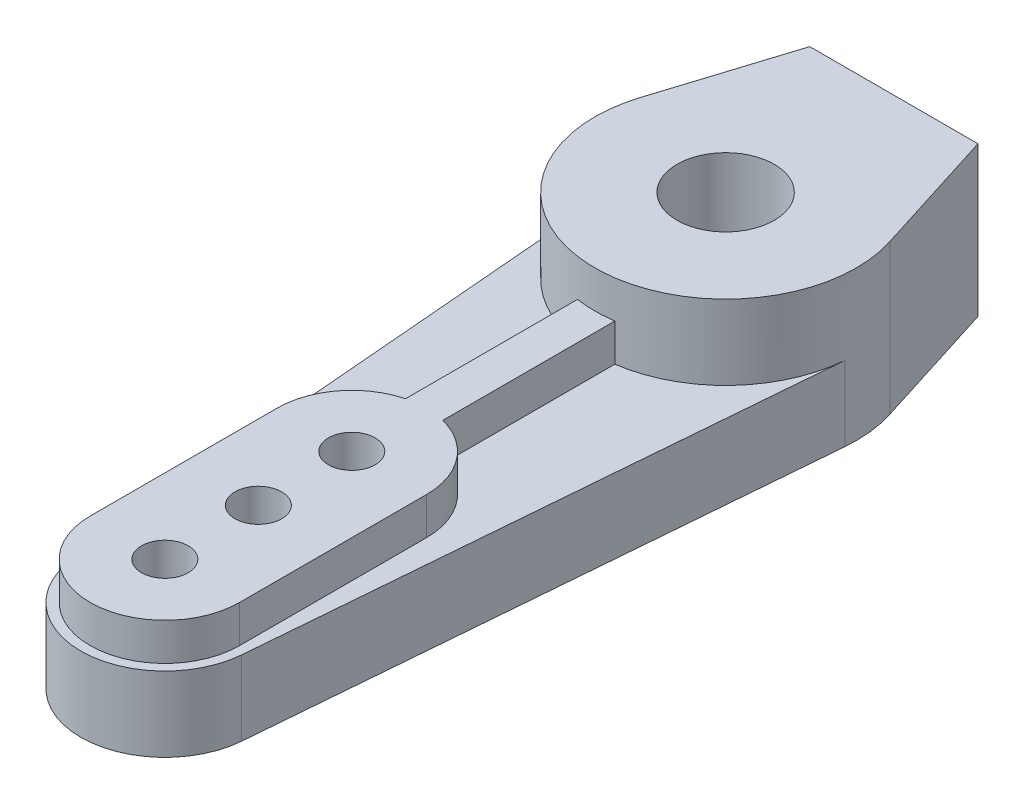
from build123d import *

# Parameters (mm, degrees)
SKETCH_1_R          = 1.25
EXTRUDE_1_DEPTH     = 4
EXTRUDE_2_DEPTH     = 4
SKETCH_3_R          = 1.25
EXTRUDE_3_DEPTH     = 2
SKETCH_4_R          = 2.6
CUT_EXTRUDE_1_DEPTH = 6
SKETCH_5_R          = 1.5
CUT_EXTRUDE_2_DEPTH = 37.100554012


with BuildPart() as part:
    # 草图1 → 凸台-拉伸1 (new body)
    with BuildSketch(Plane(origin=(0, 0, 0), x_dir=(1, 0, 0), z_dir=(0, 1, 0))):
        with BuildLine():
            Line((4.5, 9), (-4.5, 9))
            Line((-4.5, 9), (-6.675458936, 2.106714976))
            ThreePointArc((-6.675458936, 2.106714976), (-6.956816665, 0.776338774), (-6.9756521, -0.583333333))
            Line((-6.9756521, -0.583333333), (-4.484347779, -30.375))
            ThreePointArc((-4.484347779, -30.375), (0, -34.5), (4.484347779, -30.375))
            Line((4.484347779, -30.375), (6.9756521, -0.583333333))
            ThreePointArc((6.9756521, -0.583333333), (6.956816665, 0.776338774), (6.675458936, 2.106714976))
            Line((6.675458936, 2.106714976), (4.5, 9))
        make_face()
        with Locations(Location((0, -25, 0), (0, 0, 270))):
            Circle(SKETCH_1_R, mode=Mode.SUBTRACT)
        with Locations(Location((0, -20, 0), (0, 0, 270))):
            Circle(SKETCH_1_R, mode=Mode.SUBTRACT)
        with Locations(Location((0, -30, 0), (0, 0, 270))):
            Circle(SKETCH_1_R, mode=Mode.SUBTRACT)
    extrude(amount=EXTRUDE_1_DEPTH)

    # 草图2 → 凸台-拉伸2 (add)
    with BuildSketch(Plane(origin=(0, 4, 0), x_dir=(1, 0, 0), z_dir=(0, 1, 0))):
        with BuildLine():
            ThreePointArc((-6.675458936, 2.106714976), (-6.956816665, 0.776338774), (-6.9756521, -0.583333333))
            ThreePointArc((-6.9756521, -0.583333333), (0, -7), (6.9756521, -0.583333333))
            ThreePointArc((6.9756521, -0.583333333), (6.993910376, -0.291920622), (7, 0))
            ThreePointArc((7, 0), (6.918388994, 1.06578315), (6.675458936, 2.106714976))
            ThreePointArc((6.675458936, 2.106714976), (0, 7), (-6.675458936, 2.106714976))
        make_face()
        with BuildLine():
            Line((-4.5, 9), (-6.675458936, 2.106714976))
            ThreePointArc((-6.675458936, 2.106714976), (0, 7), (6.675458936, 2.106714976))
            Line((6.675458936, 2.106714976), (4.5, 9))
            Line((4.5, 9), (-4.5, 9))
        make_face()
    extrude(amount=EXTRUDE_2_DEPTH)

    # 草图3 → 凸台-拉伸3 (add)
    # profile 1 of 3: a face of its own
    with BuildSketch(Plane(origin=(0, 4, 0), x_dir=(1, 0, 0), z_dir=(0, 1, 0))):
        with BuildLine():
            Line((1, -16.980196905), (-1, -16.980196905))
            Line((-1, -16.980196905), (-1, -16.127016654))
            ThreePointArc((-1, -16.127016654), (-3.16227766, -17.550510257), (-4, -20))
            Line((-4, -20), (-4, -30))
            ThreePointArc((-4, -30), (0, -34), (4, -30))
            Line((4, -30), (4, -20))
            ThreePointArc((4, -20), (3.16227766, -17.550510257), (1, -16.127016654))
            Line((1, -16.127016654), (1, -16.980196905))
        make_face()
        with Locations(Location((0, -30, 0), (0, 0, 270))):
            Circle(SKETCH_3_R, mode=Mode.SUBTRACT)
        with Locations(Location((0, -25, 0), (0, 0, 270))):
            Circle(SKETCH_3_R, mode=Mode.SUBTRACT)
        with Locations(Location((0, -20, 0), (0, 0, 270))):
            Circle(SKETCH_3_R, mode=Mode.SUBTRACT)
    # profile 2 of 3: a face of its own
    with BuildSketch(Plane(origin=(0, 4, 0), x_dir=(1, 0, 0), z_dir=(0, 1, 0))):
        with BuildLine():
            Line((-1, -16.127016654), (-1, -16.980196905))
            Line((-1, -16.980196905), (1, -16.980196905))
            Line((1, -16.980196905), (1, -16.127016654))
            ThreePointArc((1, -16.127016654), (0, -16), (-1, -16.127016654))
        make_face()
    # profile 3 of 3: a face of its own
    with BuildSketch(Plane(origin=(0, 4, 0), x_dir=(1, 0, 0), z_dir=(0, 1, 0))):
        with BuildLine():
            Line((-1, -6.92820323), (-1, -16.127016654))
            ThreePointArc((-1, -16.127016654), (0, -16), (1, -16.127016654))
            Line((1, -16.127016654), (1, -6.92820323))
            ThreePointArc((1, -6.92820323), (0, -7), (-1, -6.92820323))
        make_face()
    extrude(amount=EXTRUDE_3_DEPTH)

    # 草图4 → 切除-拉伸1 (cut)
    with BuildSketch(Plane(origin=(0, 8, 0), x_dir=(1, 0, 0), z_dir=(0, 1, 0))):
        with Locations(Location((0, 0, 0), (0, 0, 270))):
            Circle(SKETCH_4_R)
    extrude(amount=-CUT_EXTRUDE_1_DEPTH, mode=Mode.SUBTRACT)

    # 草图5 → 切除-拉伸2 (cut, through all)
    with BuildSketch(Plane.XZ):
        with Locations(Location((0, 0, 0), (0, 0, 270))):
            Circle(SKETCH_5_R)
    extrude(amount=-CUT_EXTRUDE_2_DEPTH, mode=Mode.SUBTRACT)


solid = part.part
